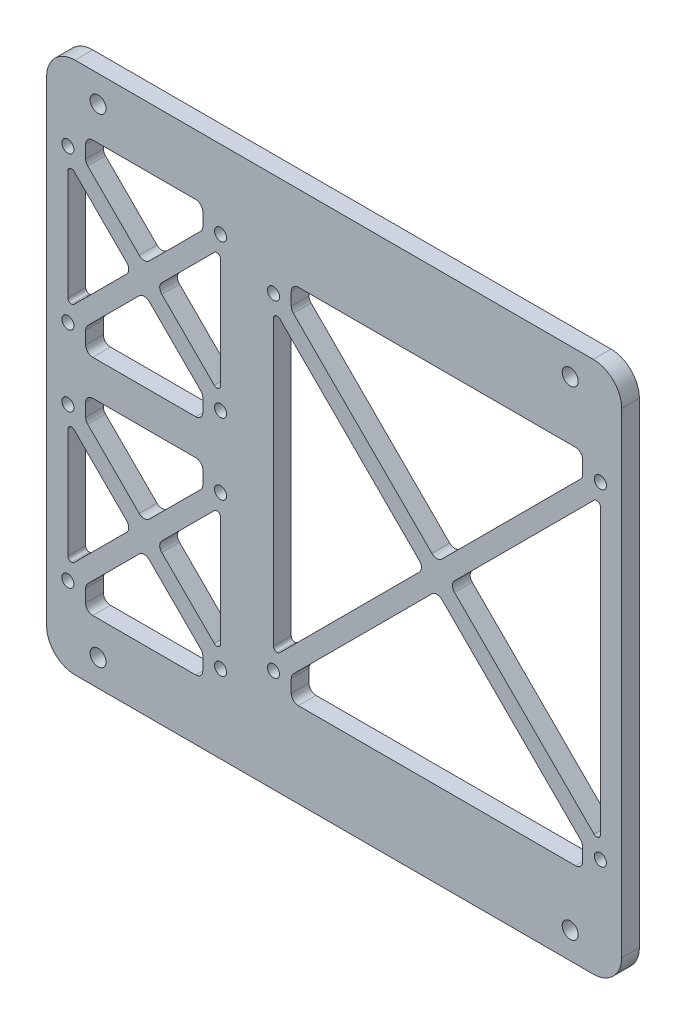
from build123d import *

# Parameters (mm, degrees)
SKETCH_1_W          = 150
SKETCH_1_H          = 162
EXTRUDE_1_DEPTH     = 5
HOLE_WIZARD_M3_1_D  = 3.4
HOLE_WIZARD_M4_1_D  = 4.5
CUT_EXTRUDE_2_DEPTH = 221.837043994
FILLET_8_R          = 8
FILLET_11_R         = 2
FILLET_13_R         = 1


with BuildPart() as part:
    # ｽｹｯﾁ1 → ﾎﾞｽ - 押し出し1 (new body)
    with BuildSketch(Plane(origin=(0, 0, 0), x_dir=(0, 1, 0), z_dir=(0, 0, 1))):
        with Locations((75, 81)):
            Rectangle(SKETCH_1_W, SKETCH_1_H)
    extrude(amount=EXTRUDE_1_DEPTH)

    # M3 すきま穴1 (through all)
    with Locations(Plane.XY.offset(5)):
        with Locations((-156, 65), (-6, 121.04), (-6, 28.96), (-98.08, 28.96), (-113, 128), (-98.08, 121.04), (-156, 85), (-113, 85), (-156, 128), (-113, 65), (-156, 22), (-113, 22)):
            Hole(HOLE_WIZARD_M3_1_D / 2)

    # M4 すきま穴1 (through all)
    with Locations(Plane.XY.offset(5)):
        with Locations((-147.5, 142.5), (-14.5, 142.5), (-14.5, 7.5), (-147.5, 7.5)):
            Hole(HOLE_WIZARD_M4_1_D / 2)

    # ｽｹｯﾁ6 → ｶｯﾄ - 押し出し2 (cut, through all)
    with BuildSketch(Plane.XY.offset(5)):
        Polygon((-93.08, 23.96), (-93.08, 30.424466094), (-52.04, 71.464466094), (-11, 30.424466094), (-11, 23.96), align=None)
        Polygon((-98.08, 116.04), (-96.615533906, 116.04), (-55.575533906, 75), (-96.615533906, 33.96), (-98.08, 33.96), align=None)
        Polygon((-93.08, 126.04), (-11, 126.04), (-11, 119.575533906), (-52.04, 78.535533906), (-93.08, 119.575533906), align=None)
        Polygon((-151, 133), (-118, 133), (-118, 126.535533906), (-134.5, 110.035533906), (-151, 126.535533906), align=None)
        Polygon((-151, 70), (-118, 70), (-118, 63.535533906), (-134.5, 47.035533906), (-151, 63.535533906), align=None)
        Polygon((-151, 17), (-118, 17), (-118, 23.464466094), (-134.5, 39.964466094), (-151, 23.464466094), align=None)
        Polygon((-154.535533906, 123), (-138.035533906, 106.5), (-154.535533906, 90), (-156, 90), (-156, 123), align=None)
        Polygon((-151, 86.464466094), (-134.5, 102.964466094), (-118, 86.464466094), (-118, 80), (-151, 80), align=None)
        Polygon((-154.535533906, 60), (-138.035533906, 43.5), (-154.535533906, 27), (-156, 27), (-156, 60), align=None)
        Polygon((-114.464466094, 123), (-113, 123), (-113, 90), (-114.464466094, 90), (-130.964466094, 106.5), align=None)
        Polygon((-130.964466094, 43.5), (-114.464466094, 60), (-113, 60), (-113, 27), (-114.464466094, 27), align=None)
        Polygon((-7.464466094, 33.96), (-6, 33.96), (-6, 116.04), (-7.464466094, 116.04), (-48.504466094, 75), align=None)
    extrude(amount=-CUT_EXTRUDE_2_DEPTH, mode=Mode.SUBTRACT)

    # ﾌｨﾚｯﾄ8
    fillet_8_edges = [part.edges().sort_by_distance(p)[0] for p in [
        (-162, 0, 2.5),
        (-162, 150, 2.5),
        (0, 150, 2.5),
        (0, 0, 2.5),
    ]]
    fillet(fillet_8_edges, radius=FILLET_8_R)

    # ﾌｨﾚｯﾄ11
    fillet_11_edges = [part.edges().sort_by_distance(p)[0] for p in [
        (-130.964466094, 43.5, 2.5),
        (-151, 17, 2.5),
        (-151, 23.464466094, 2.5),
        (-134.5, 39.964466094, 2.5),
        (-118, 23.464466094, 2.5),
        (-118, 17, 2.5),
        (-138.035533906, 43.5, 2.5),
        (-55.575533906, 75, 2.5),
        (-151, 80, 2.5),
        (-151, 86.464466094, 2.5),
        (-134.5, 102.964466094, 2.5),
        (-118, 86.464466094, 2.5),
        (-118, 80, 2.5),
        (-138.035533906, 106.5, 2.5),
        (-118, 133, 2.5),
        (-118, 126.535533906, 2.5),
        (-134.5, 110.035533906, 2.5),
        (-151, 126.535533906, 2.5),
        (-151, 133, 2.5),
        (-118, 70, 2.5),
        (-118, 63.535533906, 2.5),
        (-134.5, 47.035533906, 2.5),
        (-151, 63.535533906, 2.5),
        (-151, 70, 2.5),
        (-93.08, 119.575533906, 2.5),
        (-93.08, 126.04, 2.5),
        (-11, 126.04, 2.5),
        (-11, 119.575533906, 2.5),
        (-52.04, 78.535533906, 2.5),
        (-93.08, 30.424466094, 2.5),
        (-52.04, 71.464466094, 2.5),
        (-11, 30.424466094, 2.5),
        (-11, 23.96, 2.5),
        (-93.08, 23.96, 2.5),
        (-48.504466094, 75, 2.5),
        (-130.964466094, 106.5, 2.5),
    ]]
    fillet(fillet_11_edges, radius=FILLET_11_R)

    # ﾌｨﾚｯﾄ13
    fillet_13_edges = [part.edges().sort_by_distance(p)[0] for p in [
        (-113, 27, 2.5),
        (-114.464466094, 27, 2.5),
        (-114.464466094, 60, 2.5),
        (-113, 60, 2.5),
        (-156, 60, 2.5),
        (-154.535533906, 60, 2.5),
        (-154.535533906, 27, 2.5),
        (-156, 27, 2.5),
        (-96.615533906, 33.96, 2.5),
        (-98.08, 33.96, 2.5),
        (-98.08, 116.04, 2.5),
        (-96.615533906, 116.04, 2.5),
        (-156, 90, 2.5),
        (-156, 123, 2.5),
        (-154.535533906, 123, 2.5),
        (-154.535533906, 90, 2.5),
        (-6, 116.04, 2.5),
        (-6, 33.96, 2.5),
        (-7.464466094, 33.96, 2.5),
        (-7.464466094, 116.04, 2.5),
        (-114.464466094, 90, 2.5),
        (-114.464466094, 123, 2.5),
        (-113, 123, 2.5),
        (-113, 90, 2.5),
    ]]
    fillet(fillet_13_edges, radius=FILLET_13_R)


solid = part.part
